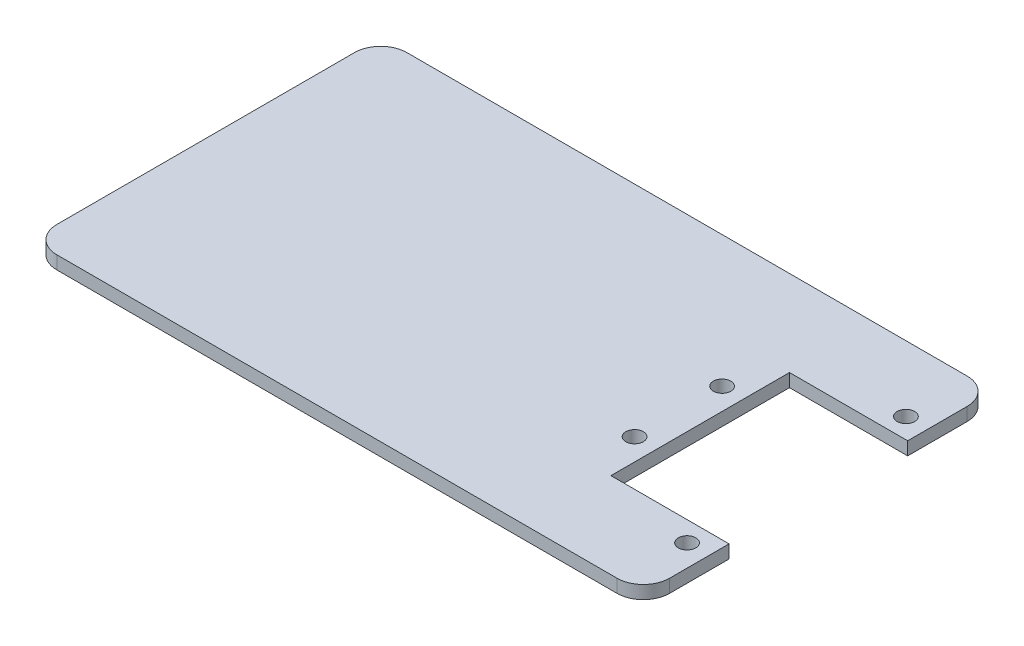
from build123d import *

# Parameters (mm, degrees)
SKETCH_1_W          = 70
SKETCH_1_H          = 40
EXTRUDE_1_DEPTH     = 1.5
FILLET_1_R          = 3
SKETCH_2_W          = 13.5
SKETCH_2_H          = 20.4
CUT_EXTRUDE_1_DEPTH = 41.339186903
SKETCH_3_R          = 1
CUT_EXTRUDE_2_DEPTH = 41.339186903


with BuildPart() as part:
    # Эскиз1 → Бобышка-Вытянуть1 (new body)
    with BuildSketch(Plane(origin=(0, 0, 0), x_dir=(1, 0, 0), z_dir=(0, 1, 0))):
        Rectangle(SKETCH_1_W, SKETCH_1_H)
    extrude(amount=EXTRUDE_1_DEPTH)

    # Скругление1
    fillet_1_edges = [part.edges().sort_by_distance(p)[0] for p in [
        (-35, 0.75, -20),
        (35, 0.75, -20),
        (35, 0.75, 20),
        (-35, 0.75, 20),
    ]]
    fillet(fillet_1_edges, radius=FILLET_1_R)

    # Эскиз2 → Вырез-Вытянуть1 (cut, through all)
    with BuildSketch(Plane(origin=(0, 1.5, 0), x_dir=(1, 0, 0), z_dir=(0, 1, 0))):
        with Locations((28.25, 0)):
            Rectangle(SKETCH_2_W, SKETCH_2_H)
    extrude(amount=-CUT_EXTRUDE_1_DEPTH, mode=Mode.SUBTRACT)

    # Эскиз3 → Вырез-Вытянуть2 (cut, through all)
    with BuildSketch(Plane.XZ):
        with Locations(Location((19, -5, 0), (0, 0, 270))):
            Circle(SKETCH_3_R)
        with Locations(Location((19, 5, 0), (0, 0, 90))):
            Circle(SKETCH_3_R)
        with Locations(Location((32.5, -12.5, 0), (0, 0, 270))):
            Circle(SKETCH_3_R)
        with Locations(Location((32.5, 12.5, 0), (0, 0, 90))):
            Circle(SKETCH_3_R)
    extrude(amount=-CUT_EXTRUDE_2_DEPTH, mode=Mode.SUBTRACT)


solid = part.part
